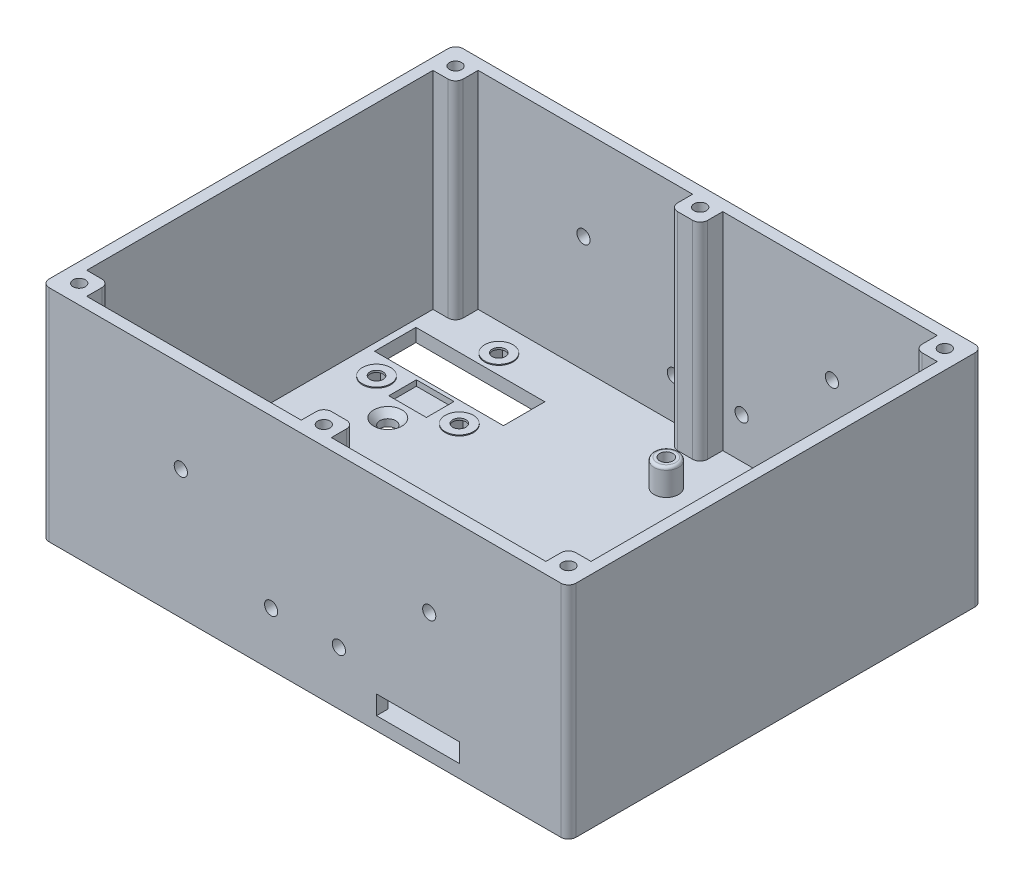
from build123d import *

# Parameters (mm, degrees)
SKETCH1_W                             = 140
SKETCH1_H                             = 110
BOTTOM_DEPTH                          = 3.5
SKETCH3_W                             = 140
SKETCH3_H                             = 110
WALL_DEPTH                            = 55
SKETCH4_R                             = 1.625
TOP_PLATE_SCREW_HOLES_DEPTH           = 30
TOP_PLATE_SCREW_HOLES_DRAFT           = -1
TOP_PLATE_SCREW_HOLES_PROFILE_2_DEPTH = 30
TOP_PLATE_SCREW_HOLES_PROFILE_2_DRAFT = -1
TOP_PLATE_SCREW_HOLES_PROFILE_3_DEPTH = 30
TOP_PLATE_SCREW_HOLES_PROFILE_3_DRAFT = -1
TOP_PLATE_SCREW_HOLES_PROFILE_4_DEPTH = 30
TOP_PLATE_SCREW_HOLES_PROFILE_4_DRAFT = -1
TOP_PLATE_SCREW_HOLES_PROFILE_5_DEPTH = 30
TOP_PLATE_SCREW_HOLES_PROFILE_5_DRAFT = -1
TOP_PLATE_SCREW_HOLES_PROFILE_6_DEPTH = 30
TOP_PLATE_SCREW_HOLES_PROFILE_6_DRAFT = -1
FILLET14_R                            = 2
FILLET13_R                            = 2
FILLET12_R                            = 2
FILLET11_R                            = 2
FILLET1_R                             = 2
FILLET2_R                             = 2
FILLET3_R                             = 2
FILLET4_R                             = 2
FILLET5_R                             = 2
FILLET6_R                             = 2
FILLET7_R                             = 2
FILLET8_R                             = 2
M4_MOUNT_R                            = 2.1
M4_MOUNT_CUT_DEPTH                    = 105.642247682
SKETCH7_R                             = 7.5
USB_CABEL_CUT_DEPTH                   = 107.523471592
FILLET9_R                             = 1
FILLET10_R                            = 1
SKETCH14_W                            = 8
SKETCH14_H                            = 7
BOSS_EXTRUDE1_DEPTH                   = 6
SKETCH16_W                            = 4
SKETCH16_H                            = 3
CUT_EXTRUDE6_DEPTH                    = 7
SKETCH9_R                             = 3.25
CURCUIT_BOARD_MOUNT_POSTS_EXT_DEPTH   = 7
SKETCH10_R                            = 1.75
M3_SCREW_CURCUIT_MOUNT_CUT_DEPTH      = 102.138518874
M3_HEAD_CIRCUIT_MOUNT_CUT_DEPTH       = 3.25
FILLET15_R                            = 0.75
FILLET16_R                            = 0.75
SKETCH18_R                            = 1.75
TOP_SCREW_DEPTH                       = 3
SKETCH19_W                            = 22
SKETCH19_H                            = 5
TOP_CABLES_DEPTH                      = 10
SKETCH20_W                            = 22
SKETCH20_H                            = 5
BOTTOM_CABLES_DEPTH                   = 3
BOTTOM_SCREW_START                    = -3
SKETCH21_R                            = 1.75
BOTTOM_SCREW_DEPTH                    = 3
SKETCH22_W                            = 34.25
SKETCH22_H                            = 11
CONNECTORS_CUT_DEPTH                  = 3.5
SKETCH24_R                            = 3.75
STANDOFFS_DEPTH                       = 0.25
M3_SCREW_HOLE_DEPTH                   = 105.642247682
M3_SCREW_HOLE_DEPTH_BACK              = 105.642247682
SKETCH23_R                            = 1.75
M3_NUT_DEPTH                          = 3.25
SKETCH26_W                            = 10
SKETCH26_H                            = 7.35
ROOM_FOR_PCB_PINS_DEPTH               = 1.5


with BuildPart() as part:
    # Sketch1 → Bottom (new body)
    with BuildSketch(Plane(origin=(0, 0, 0), x_dir=(1, 0, 0), z_dir=(0, 1, 0))):
        Rectangle(SKETCH1_W, SKETCH1_H)
    extrude(amount=BOTTOM_DEPTH)

    # Sketch3 → Wall (add)
    with BuildSketch(Plane(origin=(0, 3.5, 0), x_dir=(1, 0, 0), z_dir=(0, 1, 0))):
        Rectangle(SKETCH3_W, SKETCH3_H)
        Polygon((-61, 52), (-4, 52), (-4, 46), (4, 46), (4, 52), (61, 52), (61, 46), (67, 46), (67, -46), (61, -46), (61, -52), (4, -52), (4, -46), (-4, -46), (-4, -52), (-61, -52), (-61, -46), (-67, -46), (-67, 46), (-61, 46), align=None, mode=Mode.SUBTRACT)
    extrude(amount=WALL_DEPTH)


with BuildPart() as top_plate_screw_holes_tool:
    # Sketch4 → Top Plate Screw Holes (with draft: the straight prism first)
    with BuildSketch(Plane(origin=(0, 58.5, 0), x_dir=(1, 0, 0), z_dir=(0, 1, 0))):
        with Locations((-65, 50)):
            Circle(SKETCH4_R)
    extrude(amount=-TOP_PLATE_SCREW_HOLES_DEPTH)
    # Top Plate Screw Holes: the draft: its side faces are tilted about the plane it starts from
    top_plate_screw_holes_sides = [top_plate_screw_holes_tool.faces().sort_by_distance(p)[0] for p in [
        (-66.625, 43.5, -50),
    ]]
    draft(top_plate_screw_holes_sides, Plane(origin=(0, 58.5, 0), x_dir=(1, 0, 0), z_dir=(0, 1, 0)), TOP_PLATE_SCREW_HOLES_DRAFT)


with BuildPart() as part_1:
    add(part.part)

    # Top Plate Screw Holes: cut by top_plate_screw_holes_tool
    add(top_plate_screw_holes_tool.part, mode=Mode.SUBTRACT)


with BuildPart() as top_plate_screw_holes_profile_2_tool:
    # Sketch4 → Top Plate Screw Holes profile 2 (with draft: the straight prism first)
    with BuildSketch(Plane(origin=(0, 58.5, 0), x_dir=(1, 0, 0), z_dir=(0, 1, 0))):
        with Locations((65, 50)):
            Circle(SKETCH4_R)
    extrude(amount=-TOP_PLATE_SCREW_HOLES_PROFILE_2_DEPTH)
    # Top Plate Screw Holes profile 2: the draft: its side faces are tilted about the plane it starts from
    top_plate_screw_holes_profile_2_sides = [top_plate_screw_holes_profile_2_tool.faces().sort_by_distance(p)[0] for p in [
        (63.375, 43.5, -50),
    ]]
    draft(top_plate_screw_holes_profile_2_sides, Plane(origin=(0, 58.5, 0), x_dir=(1, 0, 0), z_dir=(0, 1, 0)), TOP_PLATE_SCREW_HOLES_PROFILE_2_DRAFT)


with BuildPart() as part_2:
    add(part_1.part)

    # Top Plate Screw Holes profile 2: cut by top_plate_screw_holes_profile_2_tool
    add(top_plate_screw_holes_profile_2_tool.part, mode=Mode.SUBTRACT)


with BuildPart() as top_plate_screw_holes_profile_3_tool:
    # Sketch4 → Top Plate Screw Holes profile 3 (with draft: the straight prism first)
    with BuildSketch(Plane(origin=(0, 58.5, 0), x_dir=(1, 0, 0), z_dir=(0, 1, 0))):
        with Locations((65, -50)):
            Circle(SKETCH4_R)
    extrude(amount=-TOP_PLATE_SCREW_HOLES_PROFILE_3_DEPTH)
    # Top Plate Screw Holes profile 3: the draft: its side faces are tilted about the plane it starts from
    top_plate_screw_holes_profile_3_sides = [top_plate_screw_holes_profile_3_tool.faces().sort_by_distance(p)[0] for p in [
        (63.375, 43.5, 50),
    ]]
    draft(top_plate_screw_holes_profile_3_sides, Plane(origin=(0, 58.5, 0), x_dir=(1, 0, 0), z_dir=(0, 1, 0)), TOP_PLATE_SCREW_HOLES_PROFILE_3_DRAFT)


with BuildPart() as part_3:
    add(part_2.part)

    # Top Plate Screw Holes profile 3: cut by top_plate_screw_holes_profile_3_tool
    add(top_plate_screw_holes_profile_3_tool.part, mode=Mode.SUBTRACT)


with BuildPart() as top_plate_screw_holes_profile_4_tool:
    # Sketch4 → Top Plate Screw Holes profile 4 (with draft: the straight prism first)
    with BuildSketch(Plane(origin=(0, 58.5, 0), x_dir=(1, 0, 0), z_dir=(0, 1, 0))):
        with Locations((-65, -50)):
            Circle(SKETCH4_R)
    extrude(amount=-TOP_PLATE_SCREW_HOLES_PROFILE_4_DEPTH)
    # Top Plate Screw Holes profile 4: the draft: its side faces are tilted about the plane it starts from
    top_plate_screw_holes_profile_4_sides = [top_plate_screw_holes_profile_4_tool.faces().sort_by_distance(p)[0] for p in [
        (-66.625, 43.5, 50),
    ]]
    draft(top_plate_screw_holes_profile_4_sides, Plane(origin=(0, 58.5, 0), x_dir=(1, 0, 0), z_dir=(0, 1, 0)), TOP_PLATE_SCREW_HOLES_PROFILE_4_DRAFT)


with BuildPart() as part_4:
    add(part_3.part)

    # Top Plate Screw Holes profile 4: cut by top_plate_screw_holes_profile_4_tool
    add(top_plate_screw_holes_profile_4_tool.part, mode=Mode.SUBTRACT)


with BuildPart() as top_plate_screw_holes_profile_5_tool:
    # Sketch4 → Top Plate Screw Holes profile 5 (with draft: the straight prism first)
    with BuildSketch(Plane(origin=(0, 58.5, 0), x_dir=(1, 0, 0), z_dir=(0, 1, 0))):
        with Locations((0, 50)):
            Circle(SKETCH4_R)
    extrude(amount=-TOP_PLATE_SCREW_HOLES_PROFILE_5_DEPTH)
    # Top Plate Screw Holes profile 5: the draft: its side faces are tilted about the plane it starts from
    top_plate_screw_holes_profile_5_sides = [top_plate_screw_holes_profile_5_tool.faces().sort_by_distance(p)[0] for p in [
        (-1.625, 43.5, -50),
    ]]
    draft(top_plate_screw_holes_profile_5_sides, Plane(origin=(0, 58.5, 0), x_dir=(1, 0, 0), z_dir=(0, 1, 0)), TOP_PLATE_SCREW_HOLES_PROFILE_5_DRAFT)


with BuildPart() as part_5:
    add(part_4.part)

    # Top Plate Screw Holes profile 5: cut by top_plate_screw_holes_profile_5_tool
    add(top_plate_screw_holes_profile_5_tool.part, mode=Mode.SUBTRACT)


with BuildPart() as top_plate_screw_holes_profile_6_tool:
    # Sketch4 → Top Plate Screw Holes profile 6 (with draft: the straight prism first)
    with BuildSketch(Plane(origin=(0, 58.5, 0), x_dir=(1, 0, 0), z_dir=(0, 1, 0))):
        with Locations((0, -50)):
            Circle(SKETCH4_R)
    extrude(amount=-TOP_PLATE_SCREW_HOLES_PROFILE_6_DEPTH)
    # Top Plate Screw Holes profile 6: the draft: its side faces are tilted about the plane it starts from
    top_plate_screw_holes_profile_6_sides = [top_plate_screw_holes_profile_6_tool.faces().sort_by_distance(p)[0] for p in [
        (-1.625, 43.5, 50),
    ]]
    draft(top_plate_screw_holes_profile_6_sides, Plane(origin=(0, 58.5, 0), x_dir=(1, 0, 0), z_dir=(0, 1, 0)), TOP_PLATE_SCREW_HOLES_PROFILE_6_DRAFT)


with BuildPart() as part_6:
    add(part_5.part)

    # Top Plate Screw Holes profile 6: cut by top_plate_screw_holes_profile_6_tool
    add(top_plate_screw_holes_profile_6_tool.part, mode=Mode.SUBTRACT)

    # Fillet14
    fillet14_edges = [part_6.edges().sort_by_distance(p)[0] for p in [
        (-4, 31, 46),
    ]]
    fillet(fillet14_edges, radius=FILLET14_R)

    # Fillet13
    fillet13_edges = [part_6.edges().sort_by_distance(p)[0] for p in [
        (4, 31, 46),
    ]]
    fillet(fillet13_edges, radius=FILLET13_R)

    # Fillet12
    fillet12_edges = [part_6.edges().sort_by_distance(p)[0] for p in [
        (-4, 31, -46),
    ]]
    fillet(fillet12_edges, radius=FILLET12_R)

    # Fillet11
    fillet11_edges = [part_6.edges().sort_by_distance(p)[0] for p in [
        (4, 31, -46),
    ]]
    fillet(fillet11_edges, radius=FILLET11_R)

    # Fillet1
    fillet1_edges = [part_6.edges().sort_by_distance(p)[0] for p in [
        (-61, 31, 46),
    ]]
    fillet(fillet1_edges, radius=FILLET1_R)

    # Fillet2
    fillet2_edges = [part_6.edges().sort_by_distance(p)[0] for p in [
        (61, 31, 46),
    ]]
    fillet(fillet2_edges, radius=FILLET2_R)

    # Fillet3
    fillet3_edges = [part_6.edges().sort_by_distance(p)[0] for p in [
        (61, 31, -46),
    ]]
    fillet(fillet3_edges, radius=FILLET3_R)

    # Fillet4
    fillet4_edges = [part_6.edges().sort_by_distance(p)[0] for p in [
        (-61, 31, -46),
    ]]
    fillet(fillet4_edges, radius=FILLET4_R)

    # Fillet5
    fillet5_edges = [part_6.edges().sort_by_distance(p)[0] for p in [
        (-70, 29.25, -55),
    ]]
    fillet(fillet5_edges, radius=FILLET5_R)

    # Fillet6
    fillet6_edges = [part_6.edges().sort_by_distance(p)[0] for p in [
        (70, 29.25, -55),
    ]]
    fillet(fillet6_edges, radius=FILLET6_R)

    # Fillet7
    fillet7_edges = [part_6.edges().sort_by_distance(p)[0] for p in [
        (70, 29.25, 55),
    ]]
    fillet(fillet7_edges, radius=FILLET7_R)

    # Fillet8
    fillet8_edges = [part_6.edges().sort_by_distance(p)[0] for p in [
        (-70, 29.25, 55),
    ]]
    fillet(fillet8_edges, radius=FILLET8_R)

    # M4 Mount → M4 Mount Cut (cut, through all)
    with BuildSketch(Plane.XZ.offset(-3.5)):
        with Locations(Location((48, -15, 0), (0, 0, 270))):
            Circle(M4_MOUNT_R)
        with Locations(Location((48, 20, 0), (0, 0, 270))):
            Circle(M4_MOUNT_R)
        with Locations(Location((-48, 20, 0), (0, 0, 90))):
            Circle(M4_MOUNT_R)
        with Locations(Location((-48, -15, 0), (0, 0, 90))):
            Circle(M4_MOUNT_R)
    extrude(amount=M4_MOUNT_CUT_DEPTH, mode=Mode.SUBTRACT)

    # Cut-Extrude3 cone 1 section (through the dimple's axis) → Cut-Extrude3 (revolve, cut)
    with BuildSketch(Plane(origin=(48, 3.5, 20), x_dir=(0, 0, 1), z_dir=(1, 0, 0))):
        Polygon((0, 0), (3.75, 0), (0, 3.75), align=None)
    revolve(axis=Axis((48, 3.5, 20), (0, -1, 0)), mode=Mode.SUBTRACT)

    # Cut-Extrude3 cone 2 section (through the dimple's axis) → Cut-Extrude3 cone 2 (revolve, cut)
    with BuildSketch(Plane(origin=(48, 3.5, -15), x_dir=(0, 0, 1), z_dir=(1, 0, 0))):
        Polygon((0, 0), (3.75, 0), (0, 3.75), align=None)
    revolve(axis=Axis((48, 3.5, -15), (0, -1, 0)), mode=Mode.SUBTRACT)

    # Cut-Extrude3 cone 3 section (through the dimple's axis) → Cut-Extrude3 cone 3 (revolve, cut)
    with BuildSketch(Plane(origin=(-48, 3.5, -15), x_dir=(0, 0, 1), z_dir=(1, 0, 0))):
        Polygon((0, 0), (3.75, 0), (0, 3.75), align=None)
    revolve(axis=Axis((-48, 3.5, -15), (0, -1, 0)), mode=Mode.SUBTRACT)

    # Cut-Extrude3 cone 4 section (through the dimple's axis) → Cut-Extrude3 cone 4 (revolve, cut)
    with BuildSketch(Plane(origin=(-48, 3.5, 20), x_dir=(0, 0, 1), z_dir=(1, 0, 0))):
        Polygon((0, 0), (3.75, 0), (0, 3.75), align=None)
    revolve(axis=Axis((-48, 3.5, 20), (0, -1, 0)), mode=Mode.SUBTRACT)

    # Sketch7 → USB Cabel Cut (cut, through all)
    with BuildSketch(Plane.XZ):
        with Locations(Location((41, -32, 0), (0, 0, 270))):
            Circle(SKETCH7_R)
    extrude(amount=-USB_CABEL_CUT_DEPTH, mode=Mode.SUBTRACT)

    # Fillet9
    fillet9_edges = [part_6.edges().sort_by_distance(p)[0] for p in [
        (41, 0, -24.5),
    ]]
    fillet(fillet9_edges, radius=FILLET9_R)

    # Fillet10
    fillet10_edges = [part_6.edges().sort_by_distance(p)[0] for p in [
        (41, 3.5, -24.5),
    ]]
    fillet(fillet10_edges, radius=FILLET10_R)

    # Sketch14 → Boss-Extrude1 (add)
    with BuildSketch(Plane(origin=(0, 3.5, 0), x_dir=(1, 0, 0), z_dir=(0, 1, 0))):
        with Locations((55, 33.5)):
            Rectangle(SKETCH14_W, SKETCH14_H)
    extrude(amount=BOSS_EXTRUDE1_DEPTH)

    # Sketch16 → Cut-Extrude6 (cut)
    with BuildSketch(Plane(origin=(18.18080474, 0, -30), x_dir=(-1, 0, 0), z_dir=(0, 0, -1))):
        with Locations((-36.81919526, 5)):
            Rectangle(SKETCH16_W, SKETCH16_H)
    extrude(amount=CUT_EXTRUDE6_DEPTH, mode=Mode.SUBTRACT)

    # Sketch9 → Curcuit Board Mount Posts EXT (add)
    with BuildSketch(Plane(origin=(0, 3.5, 0), x_dir=(1, 0, 0), z_dir=(0, 1, 0))):
        with Locations(Location((-8.5, -39, 0), (0, 0, 270))):
            Circle(SKETCH9_R)
        with Locations(Location((5, 36, 0), (0, 0, 270))):
            Circle(SKETCH9_R)
    extrude(amount=CURCUIT_BOARD_MOUNT_POSTS_EXT_DEPTH)

    # Sketch10 → M3 Screw Curcuit Mount CUT (cut, through all)
    with BuildSketch(Plane(origin=(0, 10.5, 0), x_dir=(1, 0, 0), z_dir=(0, 1, 0))):
        with Locations(Location((5, 36, 0), (0, 0, 270))):
            Circle(SKETCH10_R)
        with Locations(Location((-8.5, -39, 0), (0, 0, 270))):
            Circle(SKETCH10_R)
    extrude(amount=-M3_SCREW_CURCUIT_MOUNT_CUT_DEPTH, mode=Mode.SUBTRACT)

    # Sketch11 → M3 Head Circuit Mount CUT (cut)
    with BuildSketch(Plane.XZ):
        Polygon((-10.941005853, 37.733512563), (-8.623692632, 36.252783202), (-6.18268678, 37.519270639), (-6.058994147, 40.266487437), (-8.376307368, 41.747216798), (-10.81731322, 40.480729361), align=None)
        Polygon((5, -39.175426481), (7.75, -37.58771324), (7.75, -34.41228676), (5, -32.824573519), (2.25, -34.41228676), (2.25, -37.58771324), align=None)
    extrude(amount=-M3_HEAD_CIRCUIT_MOUNT_CUT_DEPTH, mode=Mode.SUBTRACT)

    # Fillet15
    fillet15_edges = [part_6.edges().sort_by_distance(p)[0] for p in [
        (5, 10.5, -39.25),
    ]]
    fillet(fillet15_edges, radius=FILLET15_R)

    # Fillet16
    fillet16_edges = [part_6.edges().sort_by_distance(p)[0] for p in [
        (-8.5, 10.5, 35.75),
    ]]
    fillet(fillet16_edges, radius=FILLET16_R)

    # Sketch18 → TOP-Screw (cut)
    with BuildSketch(Plane(origin=(0, 0, -55), x_dir=(-1, 0, 0), z_dir=(0, 0, -1))):
        with Locations((-33, 34.25)):
            Circle(SKETCH18_R)
        with Locations((33, 34.25)):
            Circle(SKETCH18_R)
        with Locations((-9, 14.25)):
            Circle(SKETCH18_R)
        with Locations(Location((9, 14.25, 0), (0, 0, 180))):
            Circle(SKETCH18_R)
    extrude(amount=-TOP_SCREW_DEPTH, mode=Mode.SUBTRACT)

    # Sketch19 → TOP-Cables (cut)
    with BuildSketch(Plane.XY.offset(-52)):
        with Locations((30, 6)):
            Rectangle(SKETCH19_W, SKETCH19_H)
    extrude(amount=-TOP_CABLES_DEPTH, mode=Mode.SUBTRACT)

    # Sketch20 → Bottom-Cables (cut)
    with BuildSketch(Plane.XY.offset(55)):
        with Locations((30, 6)):
            Rectangle(SKETCH20_W, SKETCH20_H)
    extrude(amount=-BOTTOM_CABLES_DEPTH, mode=Mode.SUBTRACT)

    # Sketch21 → Bottom-Screw (cut)
    with BuildSketch(Plane.XY.offset(55).offset(BOTTOM_SCREW_START)):
        with Locations(Location((-33, 34.25, 0), (0, 0, 180))):
            Circle(SKETCH21_R)
        with Locations((-9, 14.25)):
            Circle(SKETCH21_R)
        with Locations(Location((9, 14.25, 0), (0, 0, 180))):
            Circle(SKETCH21_R)
        with Locations(Location((33, 34.25, 0), (0, 0, 180))):
            Circle(SKETCH21_R)
    extrude(amount=BOTTOM_SCREW_DEPTH, mode=Mode.SUBTRACT)

    # Sketch22 → Connectors Cut (cut)
    with BuildSketch(Plane(origin=(0, 3.5, 0), x_dir=(1, 0, 0), z_dir=(0, 1, 0))):
        with Locations((-48, 34.1)):
            Rectangle(SKETCH22_W, SKETCH22_H)
    extrude(amount=-CONNECTORS_CUT_DEPTH, mode=Mode.SUBTRACT)

    # Sketch24 → Standoffs (add)
    with BuildSketch(Plane(origin=(0, 3.5, 0), x_dir=(1, 0, 0), z_dir=(0, 1, 0))):
        with Locations(Location((-59, 23, 0), (0, 0, 270))):
            Circle(SKETCH24_R)
        with Locations(Location((-48, 44.5, 0), (0, 0, 270))):
            Circle(SKETCH24_R)
        with Locations(Location((-37, 23, 0), (0, 0, 270))):
            Circle(SKETCH24_R)
    extrude(amount=STANDOFFS_DEPTH)

    # Sketch23 → M3 Screw Hole (cut, two sides: drawn at the far end of the back side and taken through both)
    with BuildSketch(Plane(origin=(0, 3.5, 0), x_dir=(1, 0, 0), z_dir=(0, 1, 0)).offset(-M3_SCREW_HOLE_DEPTH_BACK)):
        with Locations(Location((-48, 44.5, 0), (0, 0, 270))):
            Circle(SKETCH23_R)
        with Locations(Location((-37, 23, 0), (0, 0, 270))):
            Circle(SKETCH23_R)
        with Locations(Location((-59, 23, 0), (0, 0, 270))):
            Circle(SKETCH23_R)
    extrude(amount=M3_SCREW_HOLE_DEPTH + M3_SCREW_HOLE_DEPTH_BACK, mode=Mode.SUBTRACT)

    # Sketch25 → M3 Nut (cut)
    with BuildSketch(Plane.XZ):
        Polygon((-39.75, -23), (-38.375, -25.38156986), (-35.625, -25.38156986), (-34.25, -23), (-35.625, -20.61843014), (-38.375, -20.61843014), align=None)
        Polygon((-60.375, -25.38156986), (-57.625, -25.38156986), (-56.25, -23), (-57.625, -20.61843014), (-60.375, -20.61843014), (-61.75, -23), align=None)
        Polygon((-49.375, -46.88156986), (-46.625, -46.88156986), (-45.25, -44.5), (-46.625, -42.11843014), (-49.375, -42.11843014), (-50.75, -44.5), align=None)
    extrude(amount=-M3_NUT_DEPTH, mode=Mode.SUBTRACT)

    # Sketch26 → Room for PCB pins (cut)
    with BuildSketch(Plane(origin=(0, 3.5, 0), x_dir=(1, 0, 0), z_dir=(0, 1, 0))):
        with Locations((-48, 23.925)):
            Rectangle(SKETCH26_W, SKETCH26_H)
    extrude(amount=-ROOM_FOR_PCB_PINS_DEPTH, mode=Mode.SUBTRACT)


solid = part_6.part
